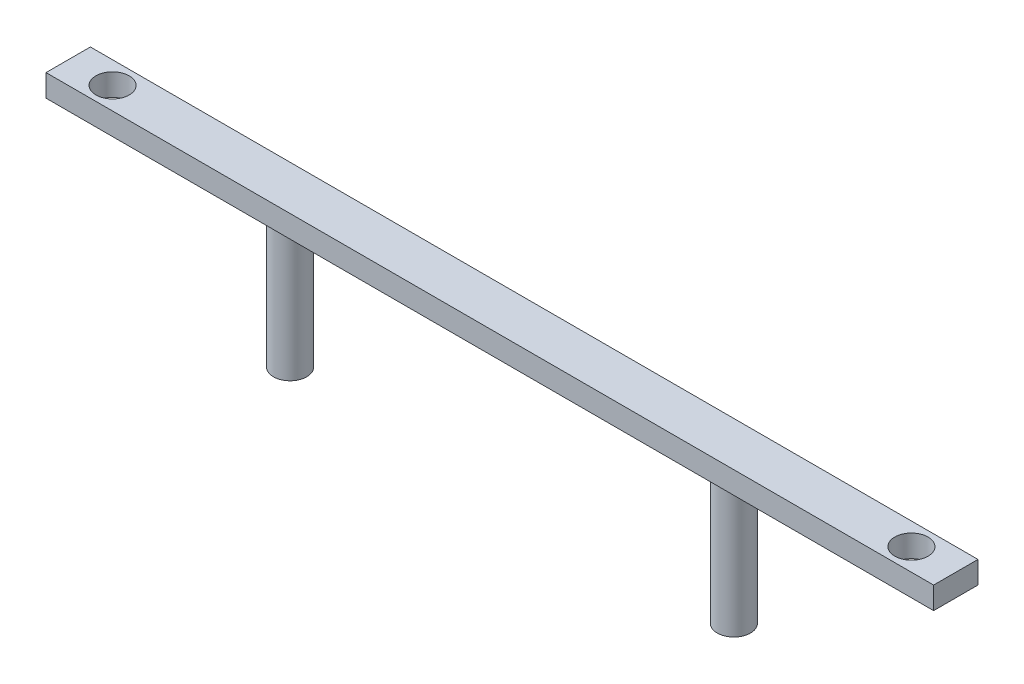
from build123d import *

# Parameters (mm, degrees)
SKETCH1_W           = 508
SKETCH1_H           = 25.4
BOSS_EXTRUDE1_DEPTH = 12.7
SKETCH2_R           = 9.525
CUT_EXTRUDE1_DEPTH  = 255.634208228
SKETCH3_R           = 9.525
BOSS_EXTRUDE2_DEPTH = 76.2


with BuildPart() as part:
    # Sketch1 → Boss-Extrude1 (new body)
    with BuildSketch(Plane(origin=(0, 0, 0), x_dir=(1, 0, 0), z_dir=(0, 1, 0))):
        Rectangle(SKETCH1_W, SKETCH1_H)
    extrude(amount=BOSS_EXTRUDE1_DEPTH)

    # Sketch2 → Cut-Extrude1 (cut, through all)
    with BuildSketch(Plane(origin=(0, 12.7, 0), x_dir=(1, 0, 0), z_dir=(0, 1, 0))):
        with Locations(Location((-228.6, 0, 0), (0, 0, 270))):
            Circle(SKETCH2_R)
        with Locations(Location((228.6, 0, 0), (0, 0, 90))):
            Circle(SKETCH2_R)
    extrude(amount=-CUT_EXTRUDE1_DEPTH, mode=Mode.SUBTRACT)

    # Sketch3 → Boss-Extrude2 (add)
    with BuildSketch(Plane.XZ):
        with Locations(Location((-127, 0, 0), (0, 0, 90))):
            Circle(SKETCH3_R)
        with Locations(Location((127, 0, 0), (0, 0, 90))):
            Circle(SKETCH3_R)
    extrude(amount=BOSS_EXTRUDE2_DEPTH)


solid = part.part
